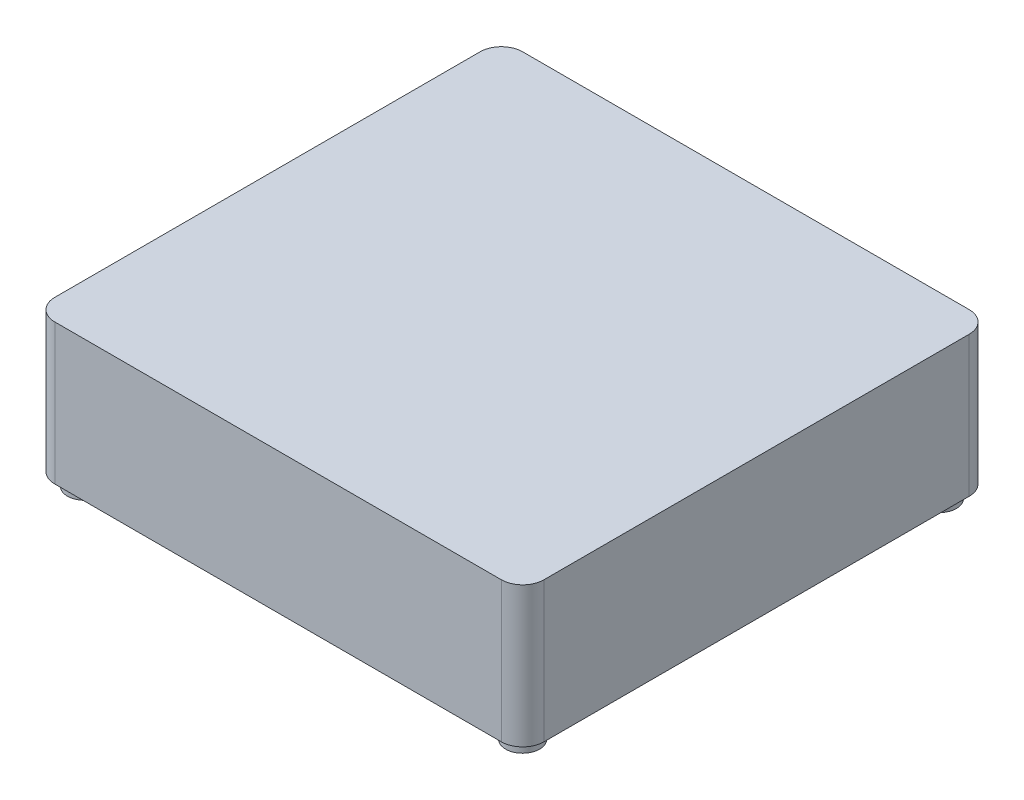
from build123d import *

# Parameters (mm, degrees)
EXTRUDE_1_DEPTH     = 33
SKETCH_2_R          = 4
EXTRUDE_2_DEPTH     = 3
SKETCH_3_W          = 10
SKETCH_3_H          = 10
SKETCH_3_W_2        = 9
SKETCH_3_H_2        = 9
CUT_EXTRUDE_1_DEPTH = 5
SKETCH_4_R          = 3.1
SKETCH_4_R_2        = 3
CUT_EXTRUDE_2_DEPTH = 10


with BuildPart() as part:
    # 草图1 → 凸台-拉伸1 (new body)
    with BuildSketch(Plane(origin=(0, 0, 0), x_dir=(1, 0, 0), z_dir=(0, 1, 0))):
        with BuildLine():
            Line((-52.5, 55), (52.5, 55))
            ThreePointArc((52.5, 55), (56.035533906, 53.535533906), (57.5, 50))
            Line((57.5, 50), (57.5, -50))
            ThreePointArc((57.5, -50), (56.035533906, -53.535533906), (52.5, -55))
            Line((52.5, -55), (-52.5, -55))
            ThreePointArc((-52.5, -55), (-56.035533906, -53.535533906), (-57.5, -50))
            Line((-57.5, -50), (-57.5, 50))
            ThreePointArc((-57.5, 50), (-56.035533906, 53.535533906), (-52.5, 55))
        make_face()
    extrude(amount=EXTRUDE_1_DEPTH)

    # 草图2 → 凸台-拉伸2 (add)
    with BuildSketch(Plane.XZ):
        with Locations(Location((-51.5, 49, 0), (0, 0, 270))):
            Circle(SKETCH_2_R)
        with Locations(Location((51.5, 49, 0), (0, 0, 270))):
            Circle(SKETCH_2_R)
        with Locations(Location((-51.5, -49, 0), (0, 0, 270))):
            Circle(SKETCH_2_R)
        with Locations(Location((51.5, -49, 0), (0, 0, 270))):
            Circle(SKETCH_2_R)
    extrude(amount=EXTRUDE_2_DEPTH)

    # 草图3 → 切除-拉伸1 (cut)
    with BuildSketch(Plane(origin=(0, 0, -55), x_dir=(-1, 0, 0), z_dir=(0, 0, -1))):
        with Locations((34.5, 10)):
            Rectangle(SKETCH_3_W, SKETCH_3_H)
        with Locations((34.5, 10)):
            Rectangle(SKETCH_3_W_2, SKETCH_3_H_2, mode=Mode.SUBTRACT)
    extrude(amount=-CUT_EXTRUDE_1_DEPTH, mode=Mode.SUBTRACT)

    # 草图4 → 切除-拉伸2 (cut)
    with BuildSketch(Plane(origin=(0, 0, -55), x_dir=(-1, 0, 0), z_dir=(0, 0, -1))):
        with Locations((34.5, 10)):
            Circle(SKETCH_4_R)
        with Locations((34.5, 10)):
            Circle(SKETCH_4_R_2, mode=Mode.SUBTRACT)
    extrude(amount=-CUT_EXTRUDE_2_DEPTH, mode=Mode.SUBTRACT)


solid = part.part
